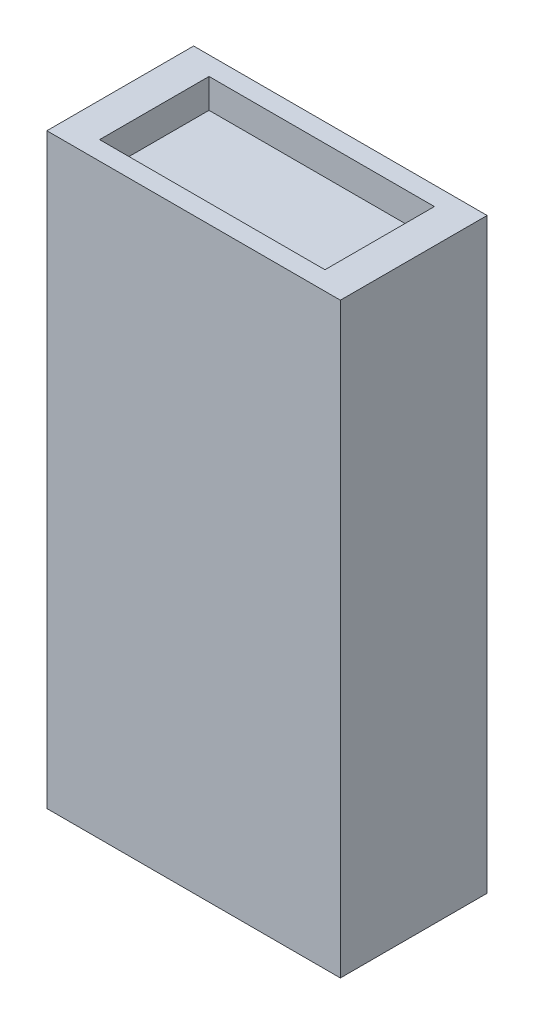
from build123d import *

# Parameters (mm, degrees)
SKETCH_1_W          = 20
SKETCH_1_H          = 40
EXTRUDE_1_DEPTH     = 10
SKETCH_2_W          = 15.357039838
SKETCH_2_H          = 7.456356594
CUT_EXTRUDE_1_DEPTH = 2


with BuildPart() as part:
    # 草图1 → 凸台-拉伸1 (new body)
    with BuildSketch(Plane.XY):
        Rectangle(SKETCH_1_W, SKETCH_1_H)
    extrude(amount=EXTRUDE_1_DEPTH)

    # 草图2 → 切除-拉伸1 (cut)
    with BuildSketch(Plane(origin=(0, 20, 0), x_dir=(1, 0, 0), z_dir=(0, 1, 0))):
        with Locations((0, -5)):
            Rectangle(SKETCH_2_W, SKETCH_2_H)
    extrude(amount=-CUT_EXTRUDE_1_DEPTH, mode=Mode.SUBTRACT)


solid = part.part
